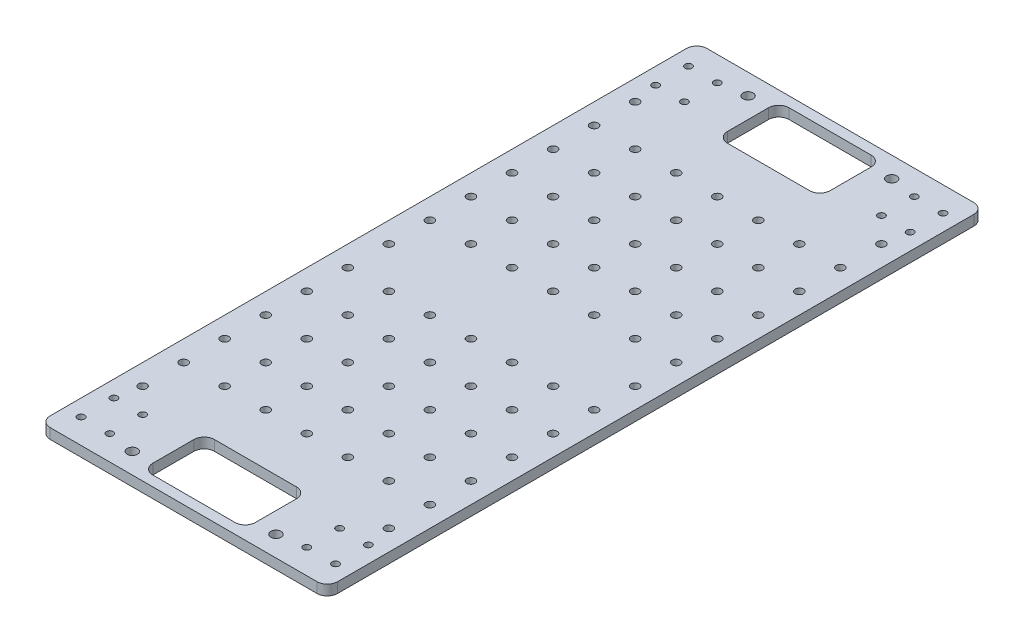
from build123d import *

# Parameters (mm, degrees)
SKETCH_1_R      = 1.7
SKETCH_1_R_2    = 2
SKETCH_1_R_3    = 2.5
EXTRUDE_2_DEPTH = 5


with BuildPart() as part:
    # 草图1 → 凸台-拉伸2 (new body)
    with BuildSketch(Plane(origin=(0, 0, 0), x_dir=(1, 0, 0), z_dir=(0, 1, 0))):
        with BuildLine():
            ThreePointArc((-65, 160), (-68.535533906, 158.535533906), (-70, 155))
            Line((-70, 155), (-70, 120))
            Line((-70, 120), (-70, 0))
            Line((-70, 0), (-70, -155))
            ThreePointArc((-70, -155), (-68.535533906, -158.535533906), (-65, -160))
            Line((-65, -160), (65, -160))
            ThreePointArc((65, -160), (68.535533906, -158.535533906), (70, -155))
            Line((70, -155), (70, 20))
            Line((70, 20), (70, 155))
            ThreePointArc((70, 155), (68.535533906, 158.535533906), (65, 160))
            Line((65, 160), (-65, 160))
        make_face()
        with Locations(Location((-62, -148, 0), (0, 0, 270))):
            Circle(SKETCH_1_R, mode=Mode.SUBTRACT)
        with Locations(Location((-48, -148, 0), (0, 0, 270))):
            Circle(SKETCH_1_R, mode=Mode.SUBTRACT)
        with Locations(Location((-62, -132, 0), (0, 0, 270))):
            Circle(SKETCH_1_R, mode=Mode.SUBTRACT)
        with Locations(Location((-60, -120, 0), (0, 0, 270))):
            Circle(SKETCH_1_R_2, mode=Mode.SUBTRACT)
        with Locations(Location((-48, -132, 0), (0, 0, 270))):
            Circle(SKETCH_1_R, mode=Mode.SUBTRACT)
        with Locations(Location((-35, -150, 0), (0, 0, 270))):
            Circle(SKETCH_1_R_3, mode=Mode.SUBTRACT)
        with Locations(Location((-60, -100, 0), (0, 0, 270))):
            Circle(SKETCH_1_R_2, mode=Mode.SUBTRACT)
        with Locations(Location((-60, -80, 0), (0, 0, 270))):
            Circle(SKETCH_1_R_2, mode=Mode.SUBTRACT)
        with Locations(Location((-40, -100, 0), (0, 0, 270))):
            Circle(SKETCH_1_R_2, mode=Mode.SUBTRACT)
        with Locations(Location((-40, -80, 0), (0, 0, 270))):
            Circle(SKETCH_1_R_2, mode=Mode.SUBTRACT)
        with BuildLine():
            Line((-20, -125), (20, -125))
            ThreePointArc((20, -125), (23.535533906, -126.464466094), (25, -130))
            Line((25, -130), (25, -150))
            ThreePointArc((25, -150), (23.535533906, -153.535533906), (20, -155))
            Line((20, -155), (-20, -155))
            ThreePointArc((-20, -155), (-23.535533906, -153.535533906), (-25, -150))
            Line((-25, -150), (-25, -130))
            ThreePointArc((-25, -130), (-23.535533906, -126.464466094), (-20, -125))
        make_face(mode=Mode.SUBTRACT)
        with Locations(Location((-20, -100, 0), (0, 0, 270))):
            Circle(SKETCH_1_R_2, mode=Mode.SUBTRACT)
        with Locations(Location((-20, -80, 0), (0, 0, 270))):
            Circle(SKETCH_1_R_2, mode=Mode.SUBTRACT)
        with Locations(Location((0, -100, 0), (0, 0, 270))):
            Circle(SKETCH_1_R_2, mode=Mode.SUBTRACT)
        with Locations(Location((0, -80, 0), (0, 0, 270))):
            Circle(SKETCH_1_R_2, mode=Mode.SUBTRACT)
        with Locations(Location((-60, -60, 0), (0, 0, 270))):
            Circle(SKETCH_1_R_2, mode=Mode.SUBTRACT)
        with Locations(Location((-60, -40, 0), (0, 0, 270))):
            Circle(SKETCH_1_R_2, mode=Mode.SUBTRACT)
        with Locations(Location((-40, -60, 0), (0, 0, 270))):
            Circle(SKETCH_1_R_2, mode=Mode.SUBTRACT)
        with Locations(Location((-40, -40, 0), (0, 0, 270))):
            Circle(SKETCH_1_R_2, mode=Mode.SUBTRACT)
        with Locations(Location((-60, -20, 0), (0, 0, 270))):
            Circle(SKETCH_1_R_2, mode=Mode.SUBTRACT)
        with Locations(Location((-40, -20, 0), (0, 0, 270))):
            Circle(SKETCH_1_R_2, mode=Mode.SUBTRACT)
        with Locations(Location((-20, -60, 0), (0, 0, 270))):
            Circle(SKETCH_1_R_2, mode=Mode.SUBTRACT)
        with Locations(Location((-20, -40, 0), (0, 0, 270))):
            Circle(SKETCH_1_R_2, mode=Mode.SUBTRACT)
        with Locations(Location((0, -60, 0), (0, 0, 270))):
            Circle(SKETCH_1_R_2, mode=Mode.SUBTRACT)
        with Locations(Location((0, -40, 0), (0, 0, 270))):
            Circle(SKETCH_1_R_2, mode=Mode.SUBTRACT)
        with Locations(Location((-20, -20, 0), (0, 0, 270))):
            Circle(SKETCH_1_R_2, mode=Mode.SUBTRACT)
        with Locations(Location((0, -20, 0), (0, 0, 270))):
            Circle(SKETCH_1_R_2, mode=Mode.SUBTRACT)
        with Locations(Location((20, -100, 0), (0, 0, 270))):
            Circle(SKETCH_1_R_2, mode=Mode.SUBTRACT)
        with Locations(Location((20, -80, 0), (0, 0, 270))):
            Circle(SKETCH_1_R_2, mode=Mode.SUBTRACT)
        with Locations(Location((35, -150, 0), (0, 0, 270))):
            Circle(SKETCH_1_R_3, mode=Mode.SUBTRACT)
        with Locations(Location((48, -148, 0), (0, 0, 270))):
            Circle(SKETCH_1_R, mode=Mode.SUBTRACT)
        with Locations(Location((62, -148, 0), (0, 0, 270))):
            Circle(SKETCH_1_R, mode=Mode.SUBTRACT)
        with Locations(Location((48, -132, 0), (0, 0, 270))):
            Circle(SKETCH_1_R, mode=Mode.SUBTRACT)
        with Locations(Location((62, -132, 0), (0, 0, 270))):
            Circle(SKETCH_1_R, mode=Mode.SUBTRACT)
        with Locations(Location((60, -120, 0), (0, 0, 270))):
            Circle(SKETCH_1_R_2, mode=Mode.SUBTRACT)
        with Locations(Location((40, -100, 0), (0, 0, 270))):
            Circle(SKETCH_1_R_2, mode=Mode.SUBTRACT)
        with Locations(Location((40, -80, 0), (0, 0, 270))):
            Circle(SKETCH_1_R_2, mode=Mode.SUBTRACT)
        with Locations(Location((60, -100, 0), (0, 0, 270))):
            Circle(SKETCH_1_R_2, mode=Mode.SUBTRACT)
        with Locations(Location((60, -80, 0), (0, 0, 270))):
            Circle(SKETCH_1_R_2, mode=Mode.SUBTRACT)
        with Locations(Location((20, -60, 0), (0, 0, 270))):
            Circle(SKETCH_1_R_2, mode=Mode.SUBTRACT)
        with Locations(Location((20, -40, 0), (0, 0, 270))):
            Circle(SKETCH_1_R_2, mode=Mode.SUBTRACT)
        with Locations(Location((20, -20, 0), (0, 0, 270))):
            Circle(SKETCH_1_R_2, mode=Mode.SUBTRACT)
        with Locations(Location((40, -60, 0), (0, 0, 270))):
            Circle(SKETCH_1_R_2, mode=Mode.SUBTRACT)
        with Locations(Location((40, -40, 0), (0, 0, 270))):
            Circle(SKETCH_1_R_2, mode=Mode.SUBTRACT)
        with Locations(Location((60, -60, 0), (0, 0, 270))):
            Circle(SKETCH_1_R_2, mode=Mode.SUBTRACT)
        with Locations(Location((60, -40, 0), (0, 0, 270))):
            Circle(SKETCH_1_R_2, mode=Mode.SUBTRACT)
        with Locations(Location((40, -20, 0), (0, 0, 270))):
            Circle(SKETCH_1_R_2, mode=Mode.SUBTRACT)
        with Locations(Location((60, -20, 0), (0, 0, 270))):
            Circle(SKETCH_1_R_2, mode=Mode.SUBTRACT)
        with Locations(Location((-60, 0, 0), (0, 0, 270))):
            Circle(SKETCH_1_R_2, mode=Mode.SUBTRACT)
        with Locations(Location((-60, 20, 0), (0, 0, 270))):
            Circle(SKETCH_1_R_2, mode=Mode.SUBTRACT)
        with Locations(Location((-40, 20, 0), (0, 0, 270))):
            Circle(SKETCH_1_R_2, mode=Mode.SUBTRACT)
        with Locations(Location((-60, 40, 0), (0, 0, 270))):
            Circle(SKETCH_1_R_2, mode=Mode.SUBTRACT)
        with Locations(Location((-60, 60, 0), (0, 0, 270))):
            Circle(SKETCH_1_R_2, mode=Mode.SUBTRACT)
        with Locations(Location((-40, 40, 0), (0, 0, 270))):
            Circle(SKETCH_1_R_2, mode=Mode.SUBTRACT)
        with Locations(Location((-40, 60, 0), (0, 0, 270))):
            Circle(SKETCH_1_R_2, mode=Mode.SUBTRACT)
        with Locations(Location((-20, 20, 0), (0, 0, 270))):
            Circle(SKETCH_1_R_2, mode=Mode.SUBTRACT)
        with Locations(Location((0, 20, 0), (0, 0, 270))):
            Circle(SKETCH_1_R_2, mode=Mode.SUBTRACT)
        with Locations(Location((-20, 40, 0), (0, 0, 270))):
            Circle(SKETCH_1_R_2, mode=Mode.SUBTRACT)
        with Locations(Location((-20, 60, 0), (0, 0, 270))):
            Circle(SKETCH_1_R_2, mode=Mode.SUBTRACT)
        with Locations(Location((0, 40, 0), (0, 0, 270))):
            Circle(SKETCH_1_R_2, mode=Mode.SUBTRACT)
        with Locations(Location((0, 60, 0), (0, 0, 270))):
            Circle(SKETCH_1_R_2, mode=Mode.SUBTRACT)
        with Locations(Location((-60, 80, 0), (0, 0, 270))):
            Circle(SKETCH_1_R_2, mode=Mode.SUBTRACT)
        with Locations(Location((-60, 100, 0), (0, 0, 270))):
            Circle(SKETCH_1_R_2, mode=Mode.SUBTRACT)
        with Locations(Location((-40, 80, 0), (0, 0, 270))):
            Circle(SKETCH_1_R_2, mode=Mode.SUBTRACT)
        with Locations(Location((-40, 100, 0), (0, 0, 270))):
            Circle(SKETCH_1_R_2, mode=Mode.SUBTRACT)
        with BuildLine():
            ThreePointArc((-58, 120), (-60, 118), (-62, 120))
            ThreePointArc((-62, 120), (-60, 122), (-58, 120))
        make_face(mode=Mode.SUBTRACT)
        with Locations(Location((-62, 132, 0), (0, 0, 270))):
            Circle(SKETCH_1_R, mode=Mode.SUBTRACT)
        with Locations(Location((-48, 132, 0), (0, 0, 270))):
            Circle(SKETCH_1_R, mode=Mode.SUBTRACT)
        with Locations(Location((-62, 148, 0), (0, 0, 270))):
            Circle(SKETCH_1_R, mode=Mode.SUBTRACT)
        with Locations(Location((-48, 148, 0), (0, 0, 270))):
            Circle(SKETCH_1_R, mode=Mode.SUBTRACT)
        with Locations(Location((-35, 150, 0), (0, 0, 270))):
            Circle(SKETCH_1_R_3, mode=Mode.SUBTRACT)
        with Locations(Location((-20, 80, 0), (0, 0, 270))):
            Circle(SKETCH_1_R_2, mode=Mode.SUBTRACT)
        with Locations(Location((-20, 100, 0), (0, 0, 270))):
            Circle(SKETCH_1_R_2, mode=Mode.SUBTRACT)
        with Locations(Location((0, 80, 0), (0, 0, 270))):
            Circle(SKETCH_1_R_2, mode=Mode.SUBTRACT)
        with Locations(Location((0, 100, 0), (0, 0, 270))):
            Circle(SKETCH_1_R_2, mode=Mode.SUBTRACT)
        with BuildLine():
            ThreePointArc((-20, 125), (-23.535533906, 126.464466094), (-25, 130))
            Line((-25, 130), (-25, 150))
            ThreePointArc((-25, 150), (-23.535533906, 153.535533906), (-20, 155))
            Line((-20, 155), (20, 155))
            ThreePointArc((20, 155), (23.535533906, 153.535533906), (25, 150))
            Line((25, 150), (25, 130))
            ThreePointArc((25, 130), (23.535533906, 126.464466094), (20, 125))
            Line((20, 125), (-20, 125))
        make_face(mode=Mode.SUBTRACT)
        with Locations(Location((20, 20, 0), (0, 0, 270))):
            Circle(SKETCH_1_R_2, mode=Mode.SUBTRACT)
        with Locations(Location((20, 40, 0), (0, 0, 270))):
            Circle(SKETCH_1_R_2, mode=Mode.SUBTRACT)
        with Locations(Location((20, 60, 0), (0, 0, 270))):
            Circle(SKETCH_1_R_2, mode=Mode.SUBTRACT)
        with Locations(Location((40, 20, 0), (0, 0, 270))):
            Circle(SKETCH_1_R_2, mode=Mode.SUBTRACT)
        with Locations(Location((60, 0, 0), (0, 0, 270))):
            Circle(SKETCH_1_R_2, mode=Mode.SUBTRACT)
        with Locations(Location((60, 20, 0), (0, 0, 270))):
            Circle(SKETCH_1_R_2, mode=Mode.SUBTRACT)
        with Locations(Location((40, 40, 0), (0, 0, 270))):
            Circle(SKETCH_1_R_2, mode=Mode.SUBTRACT)
        with Locations(Location((40, 60, 0), (0, 0, 270))):
            Circle(SKETCH_1_R_2, mode=Mode.SUBTRACT)
        with Locations(Location((60, 40, 0), (0, 0, 270))):
            Circle(SKETCH_1_R_2, mode=Mode.SUBTRACT)
        with Locations(Location((60, 60, 0), (0, 0, 270))):
            Circle(SKETCH_1_R_2, mode=Mode.SUBTRACT)
        with Locations(Location((20, 80, 0), (0, 0, 270))):
            Circle(SKETCH_1_R_2, mode=Mode.SUBTRACT)
        with Locations(Location((20, 100, 0), (0, 0, 270))):
            Circle(SKETCH_1_R_2, mode=Mode.SUBTRACT)
        with Locations(Location((40, 80, 0), (0, 0, 270))):
            Circle(SKETCH_1_R_2, mode=Mode.SUBTRACT)
        with Locations(Location((40, 100, 0), (0, 0, 270))):
            Circle(SKETCH_1_R_2, mode=Mode.SUBTRACT)
        with Locations(Location((60, 80, 0), (0, 0, 270))):
            Circle(SKETCH_1_R_2, mode=Mode.SUBTRACT)
        with Locations(Location((60, 100, 0), (0, 0, 270))):
            Circle(SKETCH_1_R_2, mode=Mode.SUBTRACT)
        with Locations(Location((35, 150, 0), (0, 0, 270))):
            Circle(SKETCH_1_R_3, mode=Mode.SUBTRACT)
        with Locations(Location((48, 132, 0), (0, 0, 270))):
            Circle(SKETCH_1_R, mode=Mode.SUBTRACT)
        with Locations(Location((60, 120, 0), (0, 0, 270))):
            Circle(SKETCH_1_R_2, mode=Mode.SUBTRACT)
        with Locations(Location((62, 132, 0), (0, 0, 270))):
            Circle(SKETCH_1_R, mode=Mode.SUBTRACT)
        with Locations(Location((48, 148, 0), (0, 0, 270))):
            Circle(SKETCH_1_R, mode=Mode.SUBTRACT)
        with Locations(Location((62, 148, 0), (0, 0, 270))):
            Circle(SKETCH_1_R, mode=Mode.SUBTRACT)
    extrude(amount=EXTRUDE_2_DEPTH)


solid = part.part
